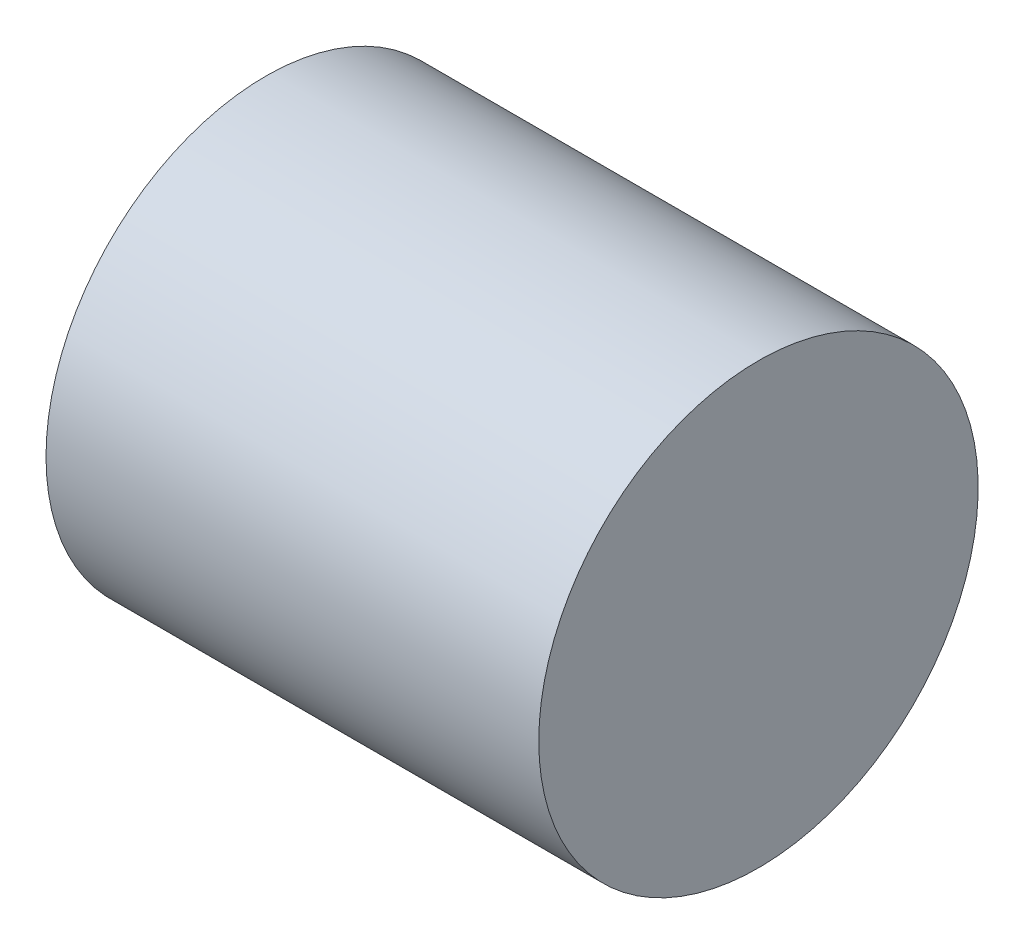
from build123d import *

# Parameters (mm, degrees)
SKETCH1_W = 1200
SKETCH1_H = 535
SHELL1_T  = -50


with BuildPart() as part:
    # Sketch1 → Revolve1 (revolve)
    with BuildSketch(Plane.XY, mode=Mode.PRIVATE) as revolve1_sk:
        with Locations((-600, 267.5)):
            Rectangle(SKETCH1_W, SKETCH1_H)
    revolve(revolve1_sk.sketch.rotate(Axis((-22.711120792, 0, 0), (1, 0, 0)), 90), axis=Axis((-22.711120792, 0, 0), (1, 0, 0)))

    # Shell1
    shell1_openings = [part.faces().sort_by_distance(p)[0] for p in [
        (-1200, 0, 0),
    ]]
    offset(amount=SHELL1_T, openings=shell1_openings, kind=Kind.INTERSECTION)


solid = part.part
